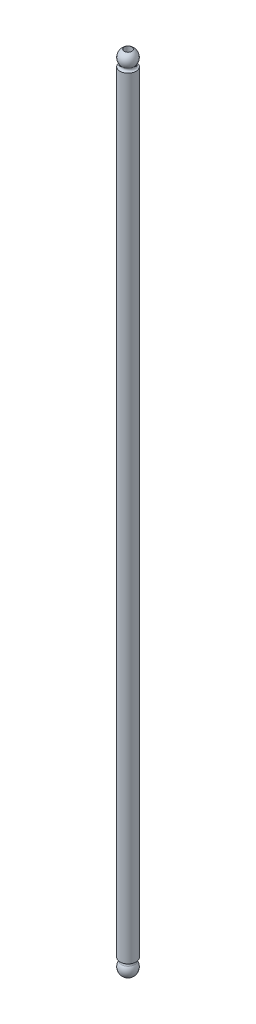
from build123d import *

# Parameters (mm, degrees)
SKETCH1_R               = 3.175
BOSS_EXTRUDE1_DEPTH     = 152.4
CUT_EXTRUDE1_DEPTH      = 159.813487305
CUT_EXTRUDE1_DEPTH_BACK = 159.813487305
SKETCH3_R               = 1.4986


with BuildPart() as part:
    # Sketch1 → Boss-Extrude1 (new, symmetric)
    with BuildSketch(Plane(origin=(0, 0, 0), x_dir=(1, 0, 0), z_dir=(0, 1, 0))):
        with Locations(Location((0, 0, 0), (0, 0, 90))):
            Circle(SKETCH1_R)
    extrude(amount=BOSS_EXTRUDE1_DEPTH, both=True)

    # Sketch2 → Revolve1 (revolve)
    with BuildSketch(Plane.XY, mode=Mode.PRIVATE) as revolve1_sk:
        with BuildLine():
            Line((0, 158.75), (0, 152.4))
            Line((0, 152.4), (-3.175, 152.4))
            ThreePointArc((-3.175, 152.4), (-2.465048417, 152.838774209), (-2.54, 153.67))
            ThreePointArc((-2.54, 153.67), (-2.839806331, 156.994903166), (0, 158.75))
        make_face()
    revolve1 = revolve(revolve1_sk.sketch.rotate(Axis((0, 158.75, 0), (0, -1, 0)), 270), axis=Axis((0, 158.75, 0), (0, -1, 0)))

    # Mirror1: Revolve1 across plane
    add(revolve1.mirror(Plane.ZX))

    # Sketch3 → Cut-Extrude1 (cut, two sides: drawn at the far end of the back side and taken through both)
    with BuildSketch(Plane(origin=(0, 0, 0), x_dir=(1, 0, 0), z_dir=(0, 1, 0)).offset(-CUT_EXTRUDE1_DEPTH_BACK)):
        Circle(SKETCH3_R)
    extrude(amount=CUT_EXTRUDE1_DEPTH + CUT_EXTRUDE1_DEPTH_BACK, mode=Mode.SUBTRACT)


solid = part.part
